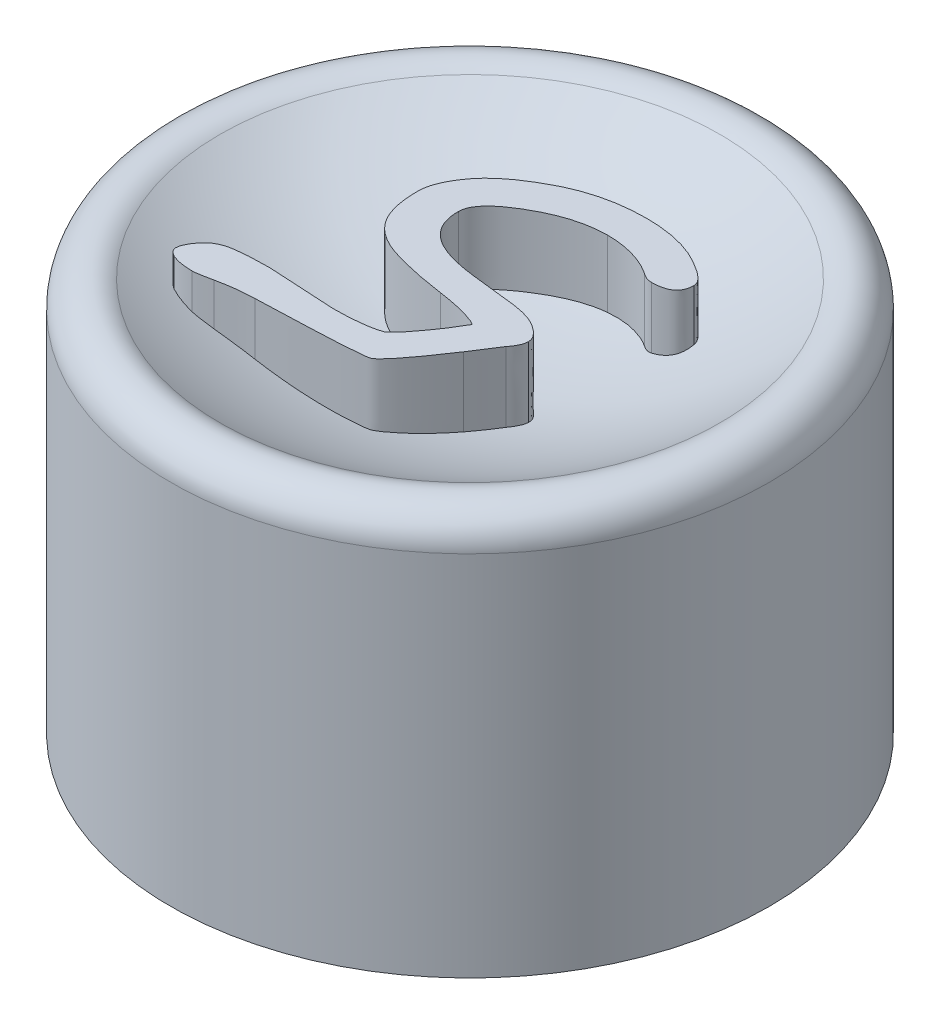
from build123d import *

# Parameters (mm, degrees)
BOSS_EXTRUDE1_REACH      = 11.257
BOSS_EXTRUDE1_END_RADIUS = 7.2532875


with BuildPart() as part:
    # Sketch1 → Revolve1 (revolve)
    with BuildSketch(Plane.XY):
        with BuildLine():
            Line((-1.5494, 0), (-1.5494, 3.048))
            Line((-1.5494, 3.048), (-0.762, 3.048))
            Line((-0.762, 3.048), (-0.762, 4.064))
            Line((-0.762, 4.064), (0, 4.064))
            Line((0, 4.064), (0, 5.08))
            ThreePointArc((0, 5.08), (-2.074697908, 5.383049508), (-3.976029965, 6.266874616))
            ThreePointArc((-3.976029965, 6.266874616), (-4.495955195, 6.288948978), (-4.7625, 5.842))
            Line((-4.7625, 5.842), (-4.7625, 0))
            Line((-4.7625, 0), (-3.4925, 0))
            Line((-3.4925, 0), (-3.4925, 4.064))
            Line((-3.4925, 4.064), (-2.0574, 4.064))
            Line((-2.0574, 4.064), (-2.0574, 0))
            Line((-2.0574, 0), (-1.5494, 0))
        make_face()
    revolve(axis=Axis((0, 0, 0), (0, -1, 0)))

    # Boss-Extrude1: up to this sphere (the profile starts inside it)
    boss_extrude1_end = Location((0, 12.3332875, 0)) * Sphere(BOSS_EXTRUDE1_END_RADIUS, mode=Mode.PRIVATE)
    # Sketch3 → Boss-Extrude1 (add, up to the surface)
    with BuildSketch(Plane(origin=(0, 6.35, 0), x_dir=(-1, 0, 0), z_dir=(0, 1, 0)), mode=Mode.PRIVATE) as boss_extrude1_sk1:
        with BuildLine():
            add(Edge.make_bspline(
                [(-0.148828125, 1.494661392), (-0.181346495, 1.461830495), (-0.252159076, 1.390337349), (-0.355692849, 1.263924291), (-0.467451815, 1.112630853), (-0.542935764, 1.002285929), (-0.583067148, 0.94362055)],
                knots=[0, 0, 0, 0, 0.788666515, 1.717414257, 2.786452946, 4, 4, 4, 4], degree=3))
            add(Edge.make_bspline(
                [(-0.583067148, 0.94362055), (-0.600823342, 0.91339292), (-0.632218003, 0.859947559), (-0.664933709, 0.80730148), (-0.679146064, 0.784430973)],
                knots=[0, 0, 0, 0, 1.131160109, 2, 2, 2, 2], degree=3))
            add(Edge.make_bspline(
                [(-0.679146064, 0.784430973), (-0.690254252, 0.766920316), (-0.708603261, 0.737995417), (-0.725980054, 0.708477762), (-0.732837223, 0.696829608)],
                knots=[0, 0, 0, 0, 1.210766994, 2, 2, 2, 2], degree=3))
            add(Edge.make_bspline(
                [(-0.732837223, 0.696829608), (-0.716380789, 0.687352693), (-0.681003621, 0.666979725), (-0.619879082, 0.642451349), (-0.549162317, 0.61793857), (-0.467970806, 0.59464958), (-0.37651412, 0.572168387), (-0.274399949, 0.55060836), (-0.16200609, 0.529841325), (-0.083247309, 0.518230829), (-0.042387757, 0.512207377)],
                knots=[0, 0, 0, 0, 0.633704574, 1.362304409, 2.194921171, 3.134330065, 4.182458358, 5.340690723, 6.620367358, 8, 8, 8, 8], degree=3))
            add(Edge.make_bspline(
                [(-0.042387757, 0.512207377), (0.010706346, 0.504240361), (0.113266653, 0.488850712), (0.261486288, 0.463343879), (0.399323975, 0.43686312), (0.526688799, 0.410243575), (0.64325081, 0.381192282), (0.749879115, 0.353933149), (0.845439746, 0.323453341), (0.957105792, 0.284629525), (1.080530656, 0.228289172), (1.209227978, 0.145636813), (1.315740061, 0.04789763), (1.399540414, -0.066076576), (1.462669886, -0.197778363), (1.505901575, -0.348985342), (1.533667237, -0.520723694), (1.536021873, -0.642503654), (1.537262658, -0.706676127)],
                knots=[0, 0, 0, 0, 1.140260755, 2.202607937, 3.193973686, 4.121299441, 4.965588163, 5.745249764, 6.458140366, 7.095127135, 8.255797553, 9.330443455, 10.330829518, 11.30848602, 12.316577354, 13.415852902, 14.638272594, 16, 16, 16, 16], degree=3))
            add(Edge.make_bspline(
                [(1.537262658, -0.706676127), (1.536411438, -0.728060135), (1.534662393, -0.771998949), (1.524129485, -0.83867132), (1.505898141, -0.907060186), (1.47999322, -0.977189315), (1.447095527, -1.049200156), (1.406965292, -1.123353168), (1.360041116, -1.199104593), (1.306090401, -1.276770765), (1.244498187, -1.355397256), (1.170806953, -1.431368995), (1.089006, -1.50775411), (0.997599947, -1.583130104), (0.89581311, -1.656567002), (0.785251684, -1.730106888), (0.663814996, -1.801083659), (0.535715449, -1.872772529), (0.400001985, -1.938235856), (0.259831117, -1.99584676), (0.115919597, -2.043912566), (-0.031578954, -2.083610755), (-0.182841328, -2.114782893), (-0.337686321, -2.136033006), (-0.495846119, -2.149781325), (-0.602505227, -2.151632039), (-0.65653926, -2.15256962)],
                knots=[0, 0, 0, 0, 0.541760768, 1.113183565, 1.705425748, 2.331923411, 3.004625893, 3.709202239, 4.466273268, 5.260531037, 6.103920736, 6.992773405, 7.938182211, 8.938183965, 9.991301099, 11.116295604, 12.300245818, 13.553241143, 14.833824769, 16.1143343, 17.389472823, 18.674371304, 19.981477442, 21.298586936, 22.631450747, 24, 24, 24, 24], degree=3))
            add(Edge.make_bspline(
                [(-0.65653926, -2.15256962), (-0.700528934, -2.152273636), (-0.786754939, -2.151693464), (-0.913582419, -2.139837708), (-1.035918427, -2.126347634), (-1.153222362, -2.102513412), (-1.266404953, -2.075608642), (-1.373849146, -2.038300517), (-1.478050951, -1.999252651), (-1.574303047, -1.950803385), (-1.662589685, -1.901512003), (-1.740826881, -1.853888485), (-1.807283977, -1.80806553), (-1.860974604, -1.763493301), (-1.904870557, -1.722535769), (-1.935047312, -1.682005697), (-1.95557862, -1.643512135), (-1.958089205, -1.617424318), (-1.959256329, -1.605296578)],
                knots=[0, 0, 0, 0, 1.423110568, 2.789498758, 4.120624063, 5.404190909, 6.661252729, 7.882474442, 9.082754132, 10.259922628, 11.365468336, 12.35548847, 13.223853038, 13.974658955, 14.614266151, 15.15899294, 15.609031491, 16, 16, 16, 16], degree=3))
            add(Edge.make_bspline(
                [(-1.959256329, -1.605296578), (-1.958525949, -1.581878513), (-1.957135928, -1.537310487), (-1.937075839, -1.47597168), (-1.907963402, -1.422342744), (-1.863368751, -1.380621842), (-1.808389096, -1.346323052), (-1.740311488, -1.325417468), (-1.661620514, -1.310565284), (-1.605172567, -1.309273904), (-1.574940665, -1.308582278)],
                knots=[0, 0, 0, 0, 1.010411753, 1.922962313, 2.770368607, 3.626905761, 4.53722092, 5.557211114, 6.691712265, 8, 8, 8, 8], degree=3))
            add(Edge.make_bspline(
                [(-1.574940665, -1.308582278), (-1.560100101, -1.309618035), (-1.529560291, -1.311749477), (-1.483135577, -1.325792356), (-1.436219639, -1.34981929), (-1.406081101, -1.370984721), (-1.390318434, -1.382054391)],
                knots=[0, 0, 0, 0, 0.881561634, 1.814130906, 2.856775049, 4, 4, 4, 4], degree=3))
            add(Edge.make_bspline(
                [(-1.390318434, -1.382054391), (-1.360782254, -1.40046331), (-1.301796654, -1.437227075), (-1.208006992, -1.483218704), (-1.110814152, -1.521666341), (-1.010733679, -1.553721444), (-0.907628979, -1.579538668), (-0.801160754, -1.597203834), (-0.691288589, -1.607682954), (-0.61700027, -1.60922417), (-0.579299347, -1.610006329)],
                knots=[0, 0, 0, 0, 0.977292708, 1.951714772, 2.929644256, 3.911623484, 4.902202541, 5.912999582, 6.940858499, 8, 8, 8, 8], degree=3))
            add(Edge.make_bspline(
                [(-0.579299347, -1.610006329), (-0.538436301, -1.609125397), (-0.456469483, -1.607358342), (-0.333188084, -1.592090492), (-0.209049797, -1.570056372), (-0.084166183, -1.537561167), (0.041340504, -1.495947012), (0.167783124, -1.444909026), (0.294827211, -1.38420492), (0.420461338, -1.316980748), (0.538294344, -1.245592985), (0.642673286, -1.172758344), (0.731564909, -1.101510313), (0.805529312, -1.031345952), (0.861253491, -0.959961422), (0.903759534, -0.890949434), (0.92863375, -0.820715117), (0.932527514, -0.773722106), (0.934414557, -0.750947785)],
                knots=[0, 0, 0, 0, 1.060843549, 2.127936599, 3.221951541, 4.333452536, 5.475783197, 6.653847602, 7.872118374, 9.130763956, 10.353039743, 11.44793562, 12.433628985, 13.310131532, 14.08825914, 14.779117039, 15.408320955, 16, 16, 16, 16], degree=3))
            add(Edge.make_bspline(
                [(0.934414557, -0.750947785), (0.933697832, -0.723285523), (0.93229878, -0.669288637), (0.921183365, -0.59045902), (0.900815481, -0.516865924), (0.875120001, -0.447338998), (0.839742699, -0.383875167), (0.79654448, -0.325461462), (0.745852659, -0.27208391), (0.687193707, -0.223399831), (0.621073151, -0.178913279), (0.545494911, -0.139599313), (0.462271339, -0.102933601), (0.369877463, -0.070935141), (0.269416788, -0.043191062), (0.160467764, -0.018243525), (0.042673167, 0.000834999), (-0.038903414, 0.011326561), (-0.081007714, 0.016741594)],
                knots=[0, 0, 0, 0, 0.935885468, 1.826853561, 2.685040896, 3.515692754, 4.328835003, 5.134166442, 5.968343773, 6.813076049, 7.708845197, 8.659389823, 9.691732404, 10.783742349, 11.964355831, 13.216962918, 14.563584977, 16, 16, 16, 16], degree=3))
            Line((-0.081007714, 0.016741594), (-0.791238133, 0.097749308))
            add(Edge.make_bspline(
                [(-0.791238133, 0.097749308), (-0.838547316, 0.104872076), (-0.928158794, 0.118363787), (-1.052953547, 0.153650977), (-1.161629248, 0.197963528), (-1.251451957, 0.253523618), (-1.322839532, 0.31203872), (-1.375255385, 0.369400469), (-1.409141608, 0.426099277), (-1.414315447, 0.465089375), (-1.416693038, 0.483006922)],
                knots=[0, 0, 0, 0, 1.468916888, 2.782373383, 3.975876886, 5.063124699, 6.015633297, 6.801708129, 7.449335776, 8, 8, 8, 8], degree=3))
            add(Edge.make_bspline(
                [(-1.416693038, 0.483006922), (-1.415386212, 0.50202794), (-1.412587758, 0.542759785), (-1.388520256, 0.603865522), (-1.353391231, 0.668926776), (-1.321591333, 0.710442358), (-1.304600969, 0.732623714)],
                knots=[0, 0, 0, 0, 0.81745602, 1.75051061, 2.798120533, 4, 4, 4, 4], degree=3))
            add(Edge.make_bspline(
                [(-1.304600969, 0.732623714), (-1.301451757, 0.73732728), (-1.292875993, 0.750135775), (-1.276756331, 0.775077029), (-1.253482357, 0.810012461), (-1.224094953, 0.856140789), (-1.187287095, 0.9118933), (-1.145272045, 0.979413694), (-1.095044509, 1.056257357), (-1.059656425, 1.111263607), (-1.040854925, 1.140488133)],
                knots=[0, 0, 0, 0, 0.279688946, 0.761633724, 1.467323567, 2.353816371, 3.46404139, 4.768170047, 6.282946057, 8, 8, 8, 8], degree=3))
            add(Edge.make_bspline(
                [(-1.040854925, 1.140488133), (-0.9996576, 1.202510201), (-0.922025109, 1.319384965), (-0.809081267, 1.481305915), (-0.708085017, 1.619953765), (-0.620626035, 1.736156216), (-0.543586705, 1.827926714), (-0.480883864, 1.898390441), (-0.429208137, 1.945433704), (-0.389365806, 1.970510103), (-0.355261475, 1.97788948), (-0.321030298, 1.98345936), (-0.27541067, 1.988750278), (-0.218272405, 1.994455969), (-0.149803659, 2.00001733), (-0.069999792, 2.005240463), (0.020968254, 2.012539309), (0.123385555, 2.017677505), (0.237387194, 2.023079028), (0.362917646, 2.030384637), (0.499882232, 2.035189122), (0.648048553, 2.042222059), (0.807534473, 2.049057447), (0.978389378, 2.054002603), (1.160784822, 2.061108212), (1.286073603, 2.065236022), (1.350756527, 2.067367089)],
                knots=[0, 0, 0, 0, 1.912714021, 3.604329988, 5.0708659, 6.319522828, 7.338834207, 8.149450077, 8.73826292, 9.135463877, 9.33500395, 9.629382747, 10.027565257, 10.513934778, 11.104733133, 11.792043086, 12.568428069, 13.448945351, 14.426121958, 15.500375365, 16.678995063, 17.946604045, 19.310914928, 20.779711585, 22.33745953, 24, 24, 24, 24], degree=3))
            add(Edge.make_bspline(
                [(1.350756527, 2.067367089), (1.398200241, 2.069053733), (1.49420709, 2.072466817), (1.63910544, 2.087157399), (1.786586642, 2.108544906), (1.884930928, 2.128727853), (1.934765625, 2.138955301)],
                knots=[0, 0, 0, 0, 0.966554524, 1.955914641, 2.964186132, 4, 4, 4, 4], degree=3))
            add(Edge.make_bspline(
                [(1.934765625, 2.138955301), (1.970512834, 2.146449074), (2.034660554, 2.159896516), (2.119924754, 2.174175171), (2.182543566, 2.185364418), (2.217013231, 2.187211842), (2.230537975, 2.187936709)],
                knots=[0, 0, 0, 0, 1.460326729, 2.620529874, 3.458742095, 4, 4, 4, 4], degree=3))
            add(Edge.make_bspline(
                [(2.230537975, 2.187936709), (2.262601777, 2.187254781), (2.325054765, 2.185926542), (2.415233826, 2.174497163), (2.499405412, 2.15616367), (2.551605889, 2.137026164), (2.577175633, 2.127651899)],
                knots=[0, 0, 0, 0, 1.086754569, 2.116750573, 3.077514078, 4, 4, 4, 4], degree=3))
            add(Edge.make_bspline(
                [(2.577175633, 2.127651899), (2.592953809, 2.118139777), (2.621701037, 2.10080906), (2.656040827, 2.06947207), (2.678348769, 2.03554852), (2.681284604, 2.011111856), (2.682674051, 1.999546677)],
                knots=[0, 0, 0, 0, 1.271431449, 2.316498941, 3.203246823, 4, 4, 4, 4], degree=3))
            add(Edge.make_bspline(
                [(2.682674051, 1.999546677), (2.6809737, 1.981466787), (2.677254151, 1.941916677), (2.652103378, 1.881491574), (2.614412632, 1.814641321), (2.563555048, 1.743759684), (2.499532161, 1.674400681), (2.418145141, 1.620582413), (2.324911597, 1.57986565), (2.217577395, 1.557275747), (2.098280489, 1.543615435), (1.965728454, 1.531907199), (1.819282179, 1.525615183), (1.716866824, 1.525081811), (1.663483979, 1.524803797)],
                knots=[0, 0, 0, 0, 0.523621858, 1.145432953, 1.874400819, 2.747920129, 3.667995995, 4.59148355, 5.553078002, 6.599056549, 7.754506547, 9.032782505, 10.453371446, 12, 12, 12, 12], degree=3))
            Line((1.663483979, 1.524803797), (0.590602749, 1.585088608))
            add(Edge.make_bspline(
                [(0.590602749, 1.585088608), (0.552287567, 1.585119309), (0.477822709, 1.585178976), (0.369208483, 1.579561225), (0.26697957, 1.574115141), (0.171326131, 1.562787417), (0.081819109, 1.551663561), (-0.000880137, 1.534829549), (-0.077742342, 1.518051762), (-0.12570058, 1.502271379), (-0.148828125, 1.494661392)],
                knots=[0, 0, 0, 0, 1.229047796, 2.388632003, 3.488940773, 4.512413514, 5.478345622, 6.381232281, 7.219359896, 8, 8, 8, 8], degree=3))
        make_face()
    boss_extrude1_tool1 = extrude(boss_extrude1_sk1.sketch, amount=-BOSS_EXTRUDE1_REACH, mode=Mode.PRIVATE) & boss_extrude1_end
    add(boss_extrude1_tool1.solids().sort_by_distance((-0.240333, 6.35, 0.085002))[0])


solid = part.part
